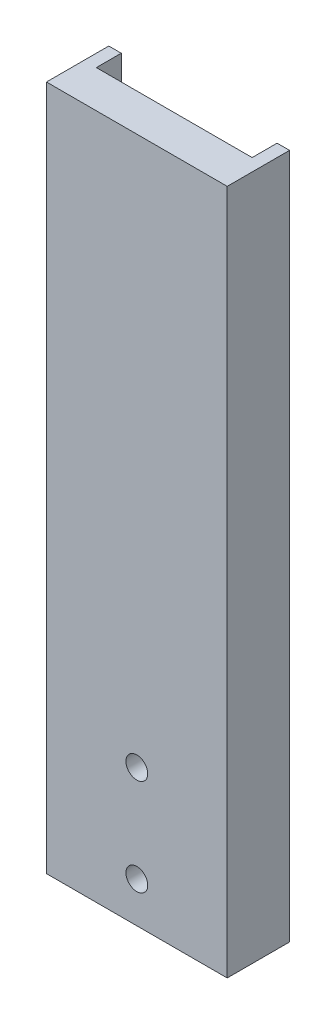
from build123d import *

# Parameters (mm, degrees)
SKETCH1_W               = 29
SKETCH1_H               = 110
BOSS_EXTRUDE1_DEPTH     = 10
CUT_EXTRUDE1_DEPTH      = 112.401301608
CUT_EXTRUDE1_DEPTH_BACK = 50
SKETCH2_W               = 25
SKETCH2_H               = 4
SKETCH3_R               = 1.75
CUT_EXTRUDE2_DEPTH      = 58.751623354
CUT_EXTRUDE3_DEPTH      = 3


with BuildPart() as part:
    # Sketch1 → Boss-Extrude1 (new body)
    with BuildSketch(Plane.XY):
        Rectangle(SKETCH1_W, SKETCH1_H)
    extrude(amount=BOSS_EXTRUDE1_DEPTH)

    # Sketch2 → Cut-Extrude1 (cut, two sides: drawn at the far end of the back side and taken through both)
    with BuildSketch(Plane(origin=(0, 55, 0), x_dir=(1, 0, 0), z_dir=(0, 1, 0)).offset(-CUT_EXTRUDE1_DEPTH_BACK)):
        with Locations((0, -2)):
            Rectangle(SKETCH2_W, SKETCH2_H)
    extrude(amount=CUT_EXTRUDE1_DEPTH + CUT_EXTRUDE1_DEPTH_BACK, mode=Mode.SUBTRACT)

    # Sketch3 → Cut-Extrude2 (cut, through all)
    with BuildSketch(Plane(origin=(0, 0, 0), x_dir=(-1, 0, 0), z_dir=(0, 0, -1))):
        with Locations((0, -48.5)):
            Circle(SKETCH3_R)
        with Locations((0, -33)):
            Circle(SKETCH3_R)
    extrude(amount=-CUT_EXTRUDE2_DEPTH, mode=Mode.SUBTRACT)

    # Sketch5 → Cut-Extrude3 (cut)
    with BuildSketch(Plane(origin=(0, 0, 0), x_dir=(-1, 0, 0), z_dir=(0, 0, -1))):
        Polygon((1.876388375, -51.75), (3.75277675, -48.5), (1.876388375, -45.25), (-1.876388375, -45.25), (-3.75277675, -48.5), (-1.876388375, -51.75), align=None)
        Polygon((1.876388375, -36.25), (3.75277675, -33), (1.876388375, -29.75), (-1.876388375, -29.75), (-3.75277675, -33), (-1.876388375, -36.25), align=None)
    extrude(amount=-CUT_EXTRUDE3_DEPTH, mode=Mode.SUBTRACT)


solid = part.part
